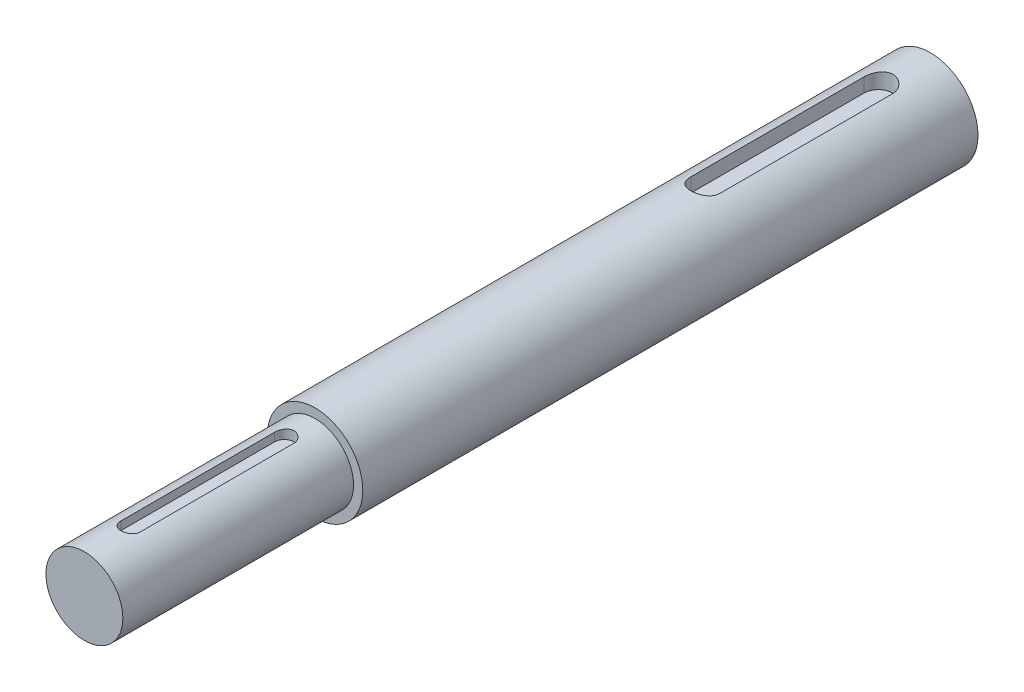
from build123d import *

# Parameters (mm, degrees)
SKETCH1_R               = 7.874
BOSS_EXTRUDE1_DEPTH     = 101.6
SKETCH2_R               = 6.35
BOSS_EXTRUDE2_DEPTH     = 38.1
CUT_EXTRUDE3_DEPTH      = 1.5875
CUT_EXTRUDE5_DEPTH      = 1.524
CUT_EXTRUDE5_DEPTH_BACK = 1.1684


with BuildPart() as part:
    # Sketch1 → Boss-Extrude1 (new body)
    with BuildSketch(Plane.XY):
        Circle(SKETCH1_R)
    extrude(amount=BOSS_EXTRUDE1_DEPTH)

    # Sketch2 → Boss-Extrude2 (add)
    with BuildSketch(Plane.XY.offset(101.6)):
        with Locations(Location((0, 0, 0), (0, 0, 180))):
            Circle(SKETCH2_R)
    extrude(amount=BOSS_EXTRUDE2_DEPTH)

    # Sketch6 → Cut-Extrude3 (cut)
    with BuildSketch(Plane(origin=(0, 6.35, 139.7), x_dir=(1, 0, 0), z_dir=(0, 1, 0))):
        with BuildLine():
            Line((1.5875, 33.02), (1.5875, 7.62))
            ThreePointArc((1.5875, 7.62), (0, 6.0325), (-1.5875, 7.62))
            Line((-1.5875, 7.62), (-1.5875, 33.02))
            ThreePointArc((-1.5875, 33.02), (0, 34.6075), (1.5875, 33.02))
        make_face()
    extrude(amount=-CUT_EXTRUDE3_DEPTH, mode=Mode.SUBTRACT)

    # Sketch7 → Cut-Extrude5 (cut, two sides: drawn at the far end of the back side and taken through both)
    with BuildSketch(Plane(origin=(0, 6.35, 139.7), x_dir=(1, 0, 0), z_dir=(0, 1, 0)).offset(-CUT_EXTRUDE5_DEPTH_BACK)):
        with BuildLine():
            Line((2.3876, 131.1275), (2.3876, 102.5525))
            ThreePointArc((2.3876, 102.5525), (0, 100.1649), (-2.3876, 102.5525))
            Line((-2.3876, 102.5525), (-2.3876, 131.1275))
            ThreePointArc((-2.3876, 131.1275), (0, 133.5151), (2.3876, 131.1275))
        make_face()
    extrude(amount=CUT_EXTRUDE5_DEPTH + CUT_EXTRUDE5_DEPTH_BACK, mode=Mode.SUBTRACT)


solid = part.part
